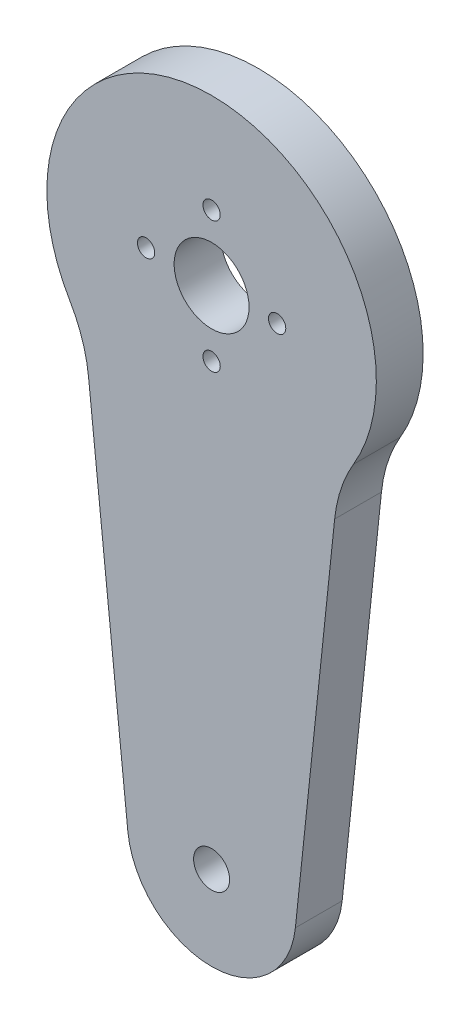
from build123d import *

# Parameters (mm, degrees)
ESQUISSE1_R        = 1.925
ESQUISSE1_R_2      = 0.925
ESQUISSE1_R_3      = 4
BOSS_EXTRU_1_DEPTH = 5


with BuildPart() as part:
    # Esquisse1 → Boss.-Extru.1 (new body)
    with BuildSketch(Plane.XY):
        with BuildLine():
            Line((8.950697062, -54.94075613), (13.146568064, -15.019708545))
            ThreePointArc((13.146568064, -15.019708545), (13.822417384, -11.87955399), (15.151330627, -8.955287839))
            ThreePointArc((15.151330627, -8.955287839), (0, 17.600000001), (-15.151330627, -8.955287839))
            ThreePointArc((-15.151330627, -8.955287839), (-13.822417384, -11.87955399), (-13.146568064, -15.019708545))
            Line((-13.146568064, -15.019708545), (-8.950697062, -54.94075613))
            ThreePointArc((-8.950697062, -54.94075613), (0, -63), (8.950697062, -54.94075613))
        make_face()
        with Locations((0, -54)):
            Circle(ESQUISSE1_R, mode=Mode.SUBTRACT)
        with Locations((7, 0)):
            Circle(ESQUISSE1_R_2, mode=Mode.SUBTRACT)
        with Locations((0, -7)):
            Circle(ESQUISSE1_R_2, mode=Mode.SUBTRACT)
        with Locations((0, 7)):
            Circle(ESQUISSE1_R_2, mode=Mode.SUBTRACT)
        with Locations((-7, 0)):
            Circle(ESQUISSE1_R_2, mode=Mode.SUBTRACT)
        Circle(ESQUISSE1_R_3, mode=Mode.SUBTRACT)
    extrude(amount=BOSS_EXTRU_1_DEPTH)


solid = part.part
